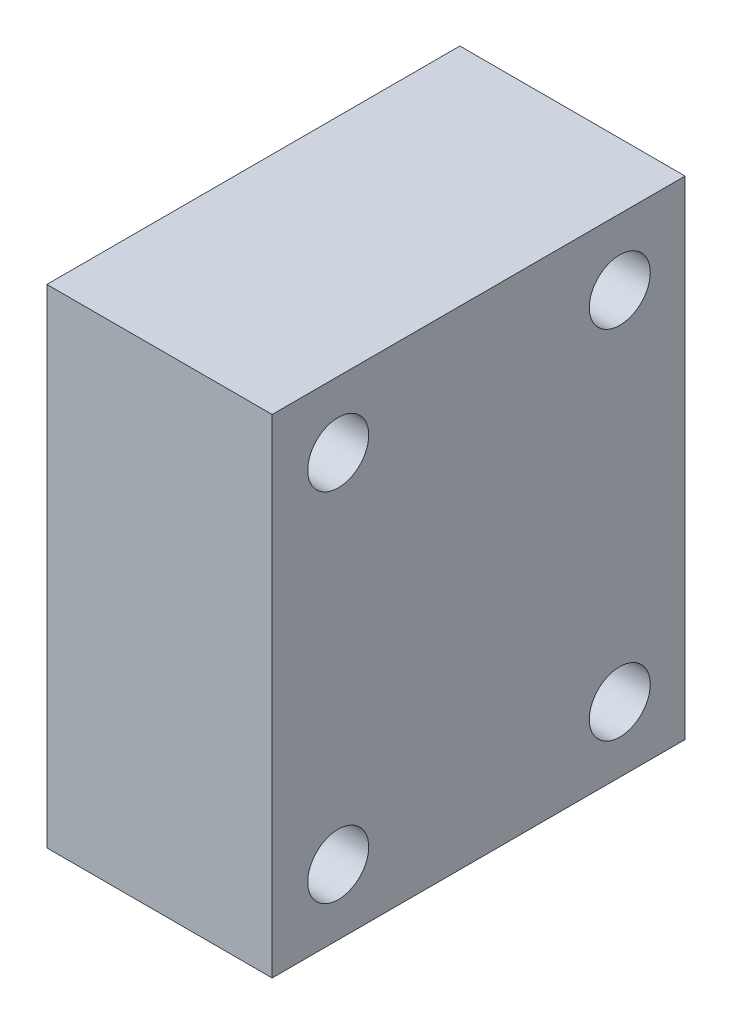
from build123d import *

# Parameters (mm, degrees)
SKETCH1_W           = 82.55
SKETCH1_H           = 69.85
BOSS_EXTRUDE1_DEPTH = 38.1
SKETCH2_R           = 5.159375
CUT_EXTRUDE2_DEPTH  = 115.652235041
SKETCH3_R           = 7.3421875
CUT_EXTRUDE3_DEPTH  = 28.448
SKETCH4_R           = 12.7254
CUT_EXTRUDE4_DEPTH  = 2.8194


with BuildPart() as part:
    # Sketch1 → Boss-Extrude1 (new body)
    with BuildSketch(Plane.YZ):
        with Locations((41.275, 34.925)):
            Rectangle(SKETCH1_W, SKETCH1_H)
    extrude(amount=BOSS_EXTRUDE1_DEPTH)

    # Sketch2 → Cut-Extrude2 (cut, through all)
    with BuildSketch(Plane.YZ):
        with Locations(Location((11.049, 11.049, 0), (0, 0, 270))):
            Circle(SKETCH2_R)
        with Locations(Location((71.374, 11.049, 0), (0, 0, 270))):
            Circle(SKETCH2_R)
        with Locations(Location((11.049, 58.674, 0), (0, 0, 270))):
            Circle(SKETCH2_R)
        with Locations(Location((71.374, 58.674, 0), (0, 0, 270))):
            Circle(SKETCH2_R)
    extrude(amount=CUT_EXTRUDE2_DEPTH, mode=Mode.SUBTRACT)

    # Sketch3 → Cut-Extrude3 (cut)
    with BuildSketch(Plane.YZ):
        with Locations(Location((23.622, 34.798, 0), (0, 0, 270))):
            Circle(SKETCH3_R)
        with Locations(Location((58.674, 34.798, 0), (0, 0, 270))):
            Circle(SKETCH3_R)
    extrude(amount=CUT_EXTRUDE3_DEPTH, mode=Mode.SUBTRACT)

    # Sketch4 → Cut-Extrude4 (cut)
    with BuildSketch(Plane.YZ):
        with Locations(Location((23.622, 34.798, 0), (0, 0, 270))):
            Circle(SKETCH4_R)
        with Locations(Location((58.674, 34.798, 0), (0, 0, 270))):
            Circle(SKETCH4_R)
    extrude(amount=CUT_EXTRUDE4_DEPTH, mode=Mode.SUBTRACT)


solid = part.part
